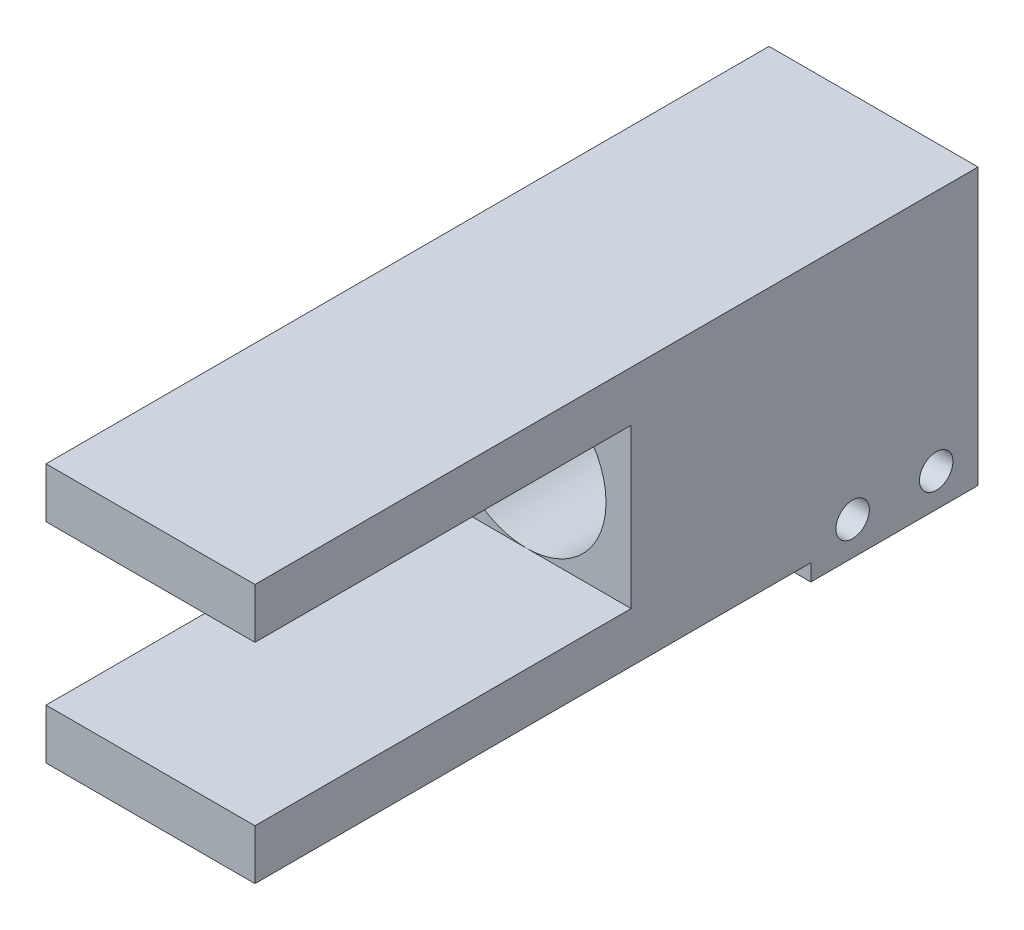
from build123d import *

# Parameters (mm, degrees)
BOSS_EXTRUDE1_DEPTH = 12.5
SKETCH2_R           = 9.5
CUT_EXTRUDE1_DEPTH  = 24.5
CUT_EXTRUDE2_REACH  = 79.945
SKETCH3_R           = 7
CUT_EXTRUDE3_REACH  = 97.897
SKETCH4_R           = 2


with BuildPart() as part:
    # Sketch1 → Boss-Extrude1 (new, symmetric)
    with BuildSketch(Plane(origin=(0, 0, 0), x_dir=(0, 0, -1), z_dir=(1, 0, 0))):
        Polygon((0, 0), (0, -33), (-20, -33), (-20, -31), (-86.5, -31), (-86.5, -25), (-41.5, -25), (-41.5, -6), (-86.5, -6), (-86.5, 0), align=None)
    extrude(amount=BOSS_EXTRUDE1_DEPTH, both=True)

    # Sketch2 → Cut-Extrude1 (cut)
    with BuildSketch(Plane.XY.offset(41.5)):
        with Locations((0, -15.5)):
            Circle(SKETCH2_R)
    extrude(amount=-CUT_EXTRUDE1_DEPTH, mode=Mode.SUBTRACT)

    # Sketch3 → Cut-Extrude2 (cut, up to next)
    with BuildSketch(Plane.XY.offset(17), mode=Mode.PRIVATE) as cut_extrude2_sk1:
        with Locations((0, -15.5)):
            Circle(SKETCH3_R)
    cut_extrude2_tool1 = extrude(cut_extrude2_sk1.sketch, amount=-CUT_EXTRUDE2_REACH, mode=Mode.PRIVATE) & part.part
    add(cut_extrude2_tool1.solids().sort_by_distance((0, -15.5, 17))[0], mode=Mode.SUBTRACT)

    # Sketch4 → Cut-Extrude3 (cut, up to next)
    with BuildSketch(Plane(origin=(12.5, 0, 0), x_dir=(0, 0, -1), z_dir=(1, 0, 0)), mode=Mode.PRIVATE) as cut_extrude3_sk1:
        with Locations((-15, -29)):
            Circle(SKETCH4_R)
    cut_extrude3_tool1 = extrude(cut_extrude3_sk1.sketch, amount=-CUT_EXTRUDE3_REACH, mode=Mode.PRIVATE) & part.part
    # Sketch4 → Cut-Extrude3 (cut, up to next)
    with BuildSketch(Plane(origin=(12.5, 0, 0), x_dir=(0, 0, -1), z_dir=(1, 0, 0)), mode=Mode.PRIVATE) as cut_extrude3_sk2:
        with Locations((-5, -29)):
            Circle(SKETCH4_R)
    cut_extrude3_tool2 = extrude(cut_extrude3_sk2.sketch, amount=-CUT_EXTRUDE3_REACH, mode=Mode.PRIVATE) & part.part
    add(cut_extrude3_tool1.solids().sort_by_distance((12.5, -29, 15))[0], mode=Mode.SUBTRACT)
    add(cut_extrude3_tool2.solids().sort_by_distance((12.5, -29, 5))[0], mode=Mode.SUBTRACT)


solid = part.part
